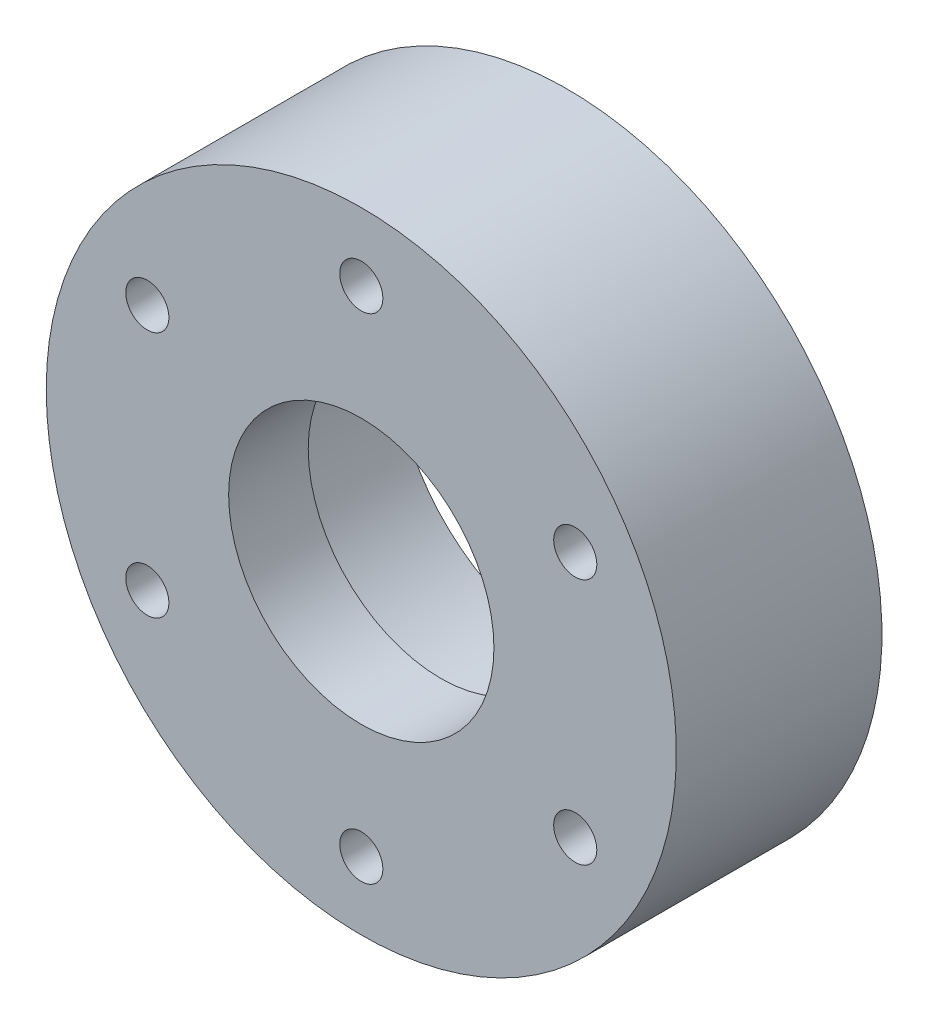
from build123d import *

# Parameters (mm, degrees)
SKETCH2_R          = 3.25
CUT_EXTRUDE1_DEPTH = 74.98310618
CIRPATTERN1_COUNT  = 6


with BuildPart() as part:
    # Sketch1 → Revolve1 (revolve)
    with BuildSketch(Plane(origin=(0, 0, 0), x_dir=(0, 0, -1), z_dir=(1, 0, 0)), mode=Mode.PRIVATE) as revolve1_sk:
        Polygon((-31, 47.5), (0, 47.5), (0, 26), (-19, 26), (-19, 20), (-31, 20), align=None)
    revolve(revolve1_sk.sketch.rotate(Axis((0, 0, 0), (0, 0, 1)), 90), axis=Axis((0, 0, 0), (0, 0, 1)))

    # Sketch2 → Cut-Extrude1 (cut, through all)
    with BuildSketch(Plane.XY.offset(31)):
        with Locations((0, 37.25)):
            Circle(SKETCH2_R)
    cut_extrude1 = extrude(amount=-CUT_EXTRUDE1_DEPTH, mode=Mode.SUBTRACT)

    # CirPattern1: Cut-Extrude1 ×6 about axis
    cirpattern1_axis = Axis((0, 0, 0), (0, 0, 1))
    for i in range(1, CIRPATTERN1_COUNT):
        add(cut_extrude1.rotate(cirpattern1_axis, i * 360 / CIRPATTERN1_COUNT), mode=Mode.SUBTRACT)


solid = part.part
